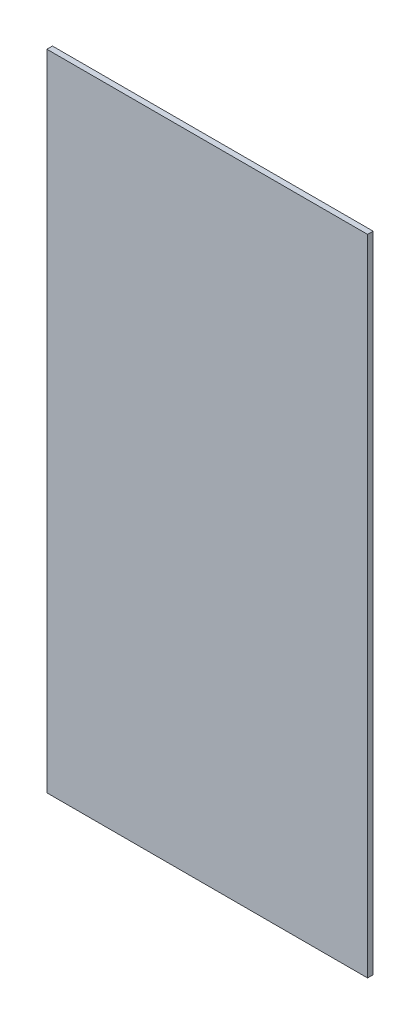
from build123d import *

# Parameters (mm, degrees)
ESQUISSE1_W        = 375
ESQUISSE1_H        = 753
BOSS_EXTRU_1_DEPTH = 6.5


with BuildPart() as part:
    # Esquisse1 → Boss.-Extru.1 (new body)
    with BuildSketch(Plane.XY):
        Rectangle(ESQUISSE1_W, ESQUISSE1_H)
    extrude(amount=BOSS_EXTRU_1_DEPTH)


solid = part.part
